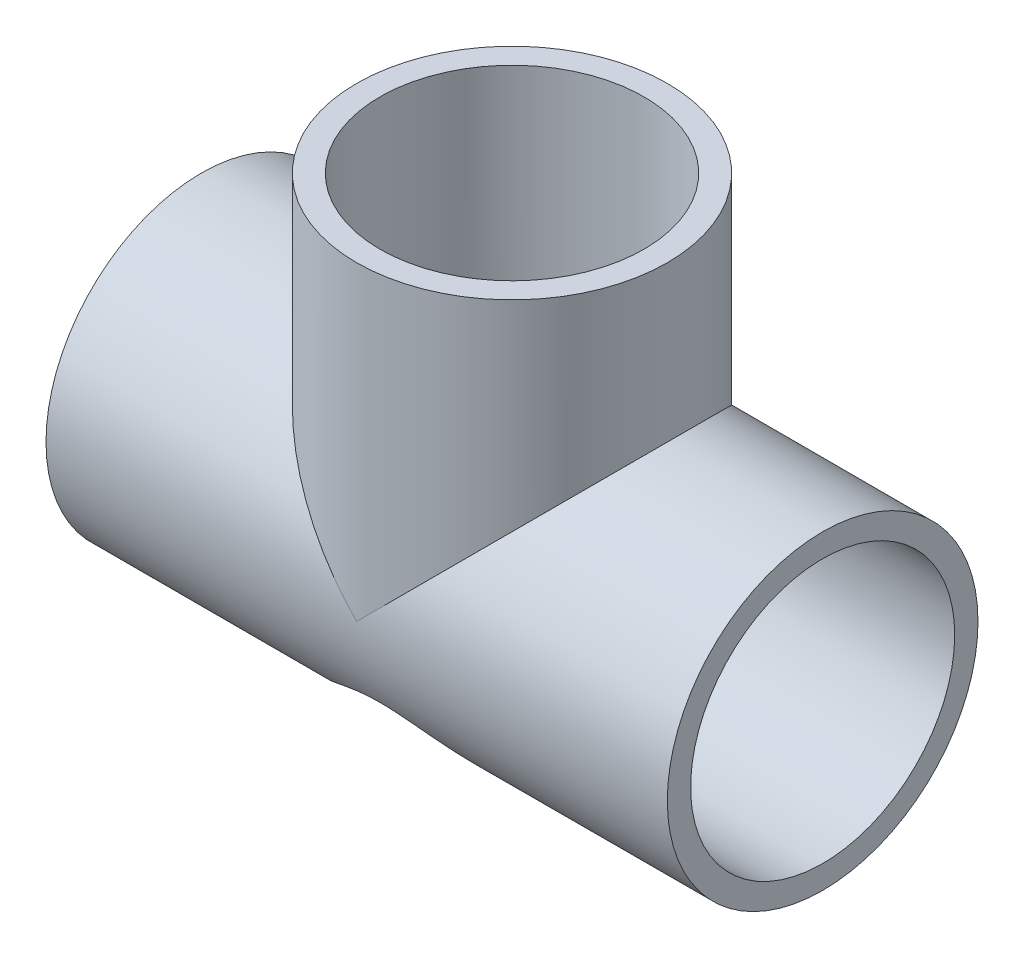
from build123d import *

# Parameters (mm, degrees)
SKETCH_1_R          = 50
SKETCH_1_R_2        = 42.5
EXTRUDE_1_DEPTH     = 50
SKETCH_1_2_R        = 50
SKETCH_1_2_R_2      = 42.5
EXTRUDE_2_DEPTH     = 100
EXTRUDE_3_REACH     = 189.083
SKETCH_2_R          = 50
SKETCH_2_R_2        = 42.5
SKETCH_3_R          = 42.5
CUT_EXTRUDE_1_DEPTH = 200
SKETCH_3_2_R        = 42.5
CUT_EXTRUDE_2_DEPTH = 100


with BuildPart() as part:
    # 草图1 → 凸台-拉伸1 (new, symmetric)
    with BuildSketch(Plane(origin=(0, 0, 0), x_dir=(0, 0, -1), z_dir=(1, 0, 0))):
        Circle(SKETCH_1_R)
        Circle(SKETCH_1_R_2, mode=Mode.SUBTRACT)
    extrude(amount=EXTRUDE_1_DEPTH, both=True)

    # 草图1<2> → 凸台-拉伸2 (add, symmetric)
    with BuildSketch(Plane(origin=(0, 0, 0), x_dir=(0, 0, -1), z_dir=(1, 0, 0))):
        Circle(SKETCH_1_2_R)
        Circle(SKETCH_1_2_R_2, mode=Mode.SUBTRACT)
    extrude(amount=EXTRUDE_2_DEPTH, both=True)

    # 草图2 → 凸台-拉伸3 (add, up to next)
    with BuildSketch(Plane(origin=(0, 100, 0), x_dir=(1, 0, 0), z_dir=(0, 1, 0)), mode=Mode.PRIVATE) as extrude_3_sk1:
        Circle(SKETCH_2_R)
        Circle(SKETCH_2_R_2, mode=Mode.SUBTRACT)
    extrude_3_tool1 = extrude(extrude_3_sk1.sketch, amount=-EXTRUDE_3_REACH, mode=Mode.PRIVATE) - part.part
    add(extrude_3_tool1.solids().sort_by_distance((-48.585786, 100, 0))[0])

    # 草图3 → 切除-拉伸1 (cut)
    with BuildSketch(Plane(origin=(0, 0, 0), x_dir=(1, 0, 0), z_dir=(0, 1, 0))):
        Circle(SKETCH_3_R)
    extrude(amount=-CUT_EXTRUDE_1_DEPTH, mode=Mode.SUBTRACT)

    # 草图3<2> → 切除-拉伸2 (cut, symmetric)
    with BuildSketch(Plane(origin=(0, 0, 0), x_dir=(1, 0, 0), z_dir=(0, 1, 0))):
        Circle(SKETCH_3_2_R)
    extrude(amount=CUT_EXTRUDE_2_DEPTH, both=True, mode=Mode.SUBTRACT)


solid = part.part
